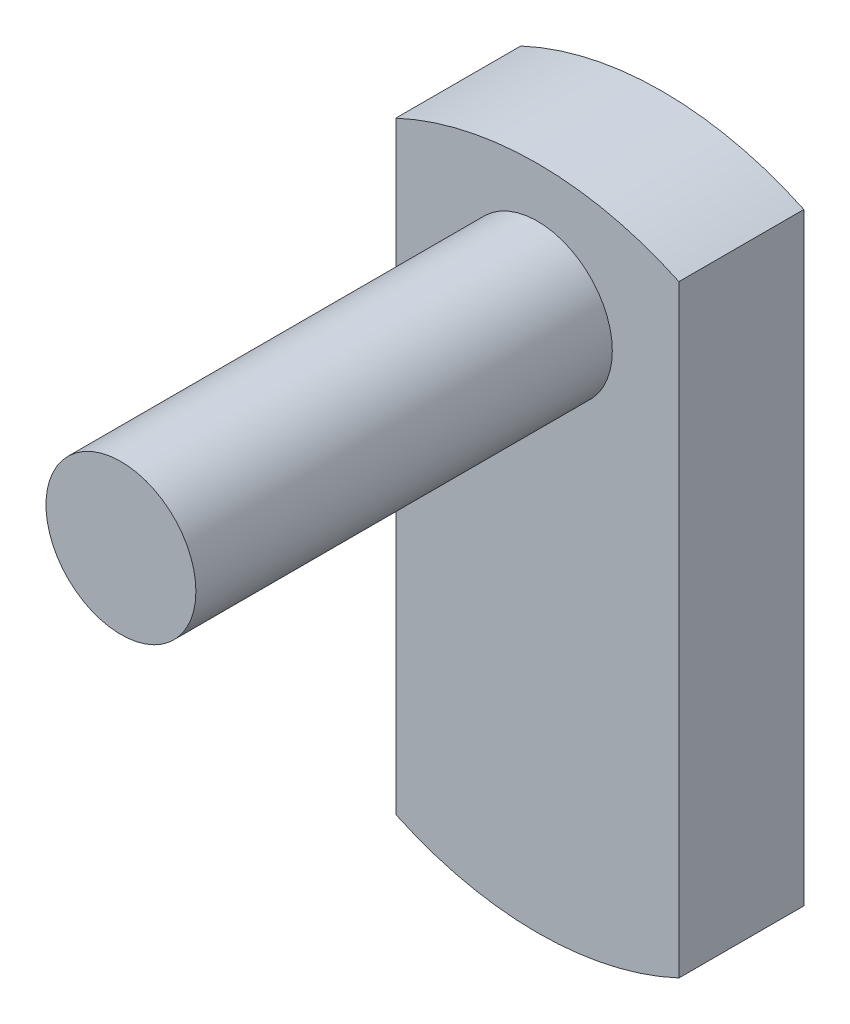
from build123d import *

# Parameters (mm, degrees)
CROQUIS1_R              = 40
SALIENTE_EXTRUIR1_DEPTH = 15
CROQUIS3_R              = 9
SALIENTE_EXTRUIR2_DEPTH = 50
CROQUIS4_W              = 30
CROQUIS4_H              = 30
CORTAR_EXTRUIR1_DEPTH   = 10
CORTAR_EXTRUIR3_DEPTH   = 76.498344353


with BuildPart() as part:
    # Croquis1 → Saliente-Extruir1 (new body)
    with BuildSketch(Plane.XY):
        Circle(CROQUIS1_R)
    extrude(amount=SALIENTE_EXTRUIR1_DEPTH)

    # Croquis3 → Saliente-Extruir2 (add)
    with BuildSketch(Plane.XY.offset(15)):
        with Locations((0, 25)):
            Circle(CROQUIS3_R)
    extrude(amount=SALIENTE_EXTRUIR2_DEPTH)

    # Croquis4 → Cortar-Extruir1 (cut)
    with BuildSketch(Plane(origin=(0, 0, 0), x_dir=(-1, 0, 0), z_dir=(0, 0, -1))):
        with Locations((0, -15)):
            Rectangle(CROQUIS4_W, CROQUIS4_H)
    extrude(amount=-CORTAR_EXTRUIR1_DEPTH, mode=Mode.SUBTRACT)

    # Croquis5 → Cortar-Extruir3 (cut, through all)
    with BuildSketch(Plane.XY.offset(15)):
        with BuildLine():
            Line((-17, 36.20773398), (-17, -36.20773398))
            ThreePointArc((-17, -36.20773398), (-40, 0), (-17, 36.20773398))
        make_face()
        with BuildLine():
            Line((17, 36.20773398), (17, -36.20773398))
            ThreePointArc((17, -36.20773398), (40, 0), (17, 36.20773398))
        make_face()
    extrude(amount=-CORTAR_EXTRUIR3_DEPTH, mode=Mode.SUBTRACT)


solid = part.part
